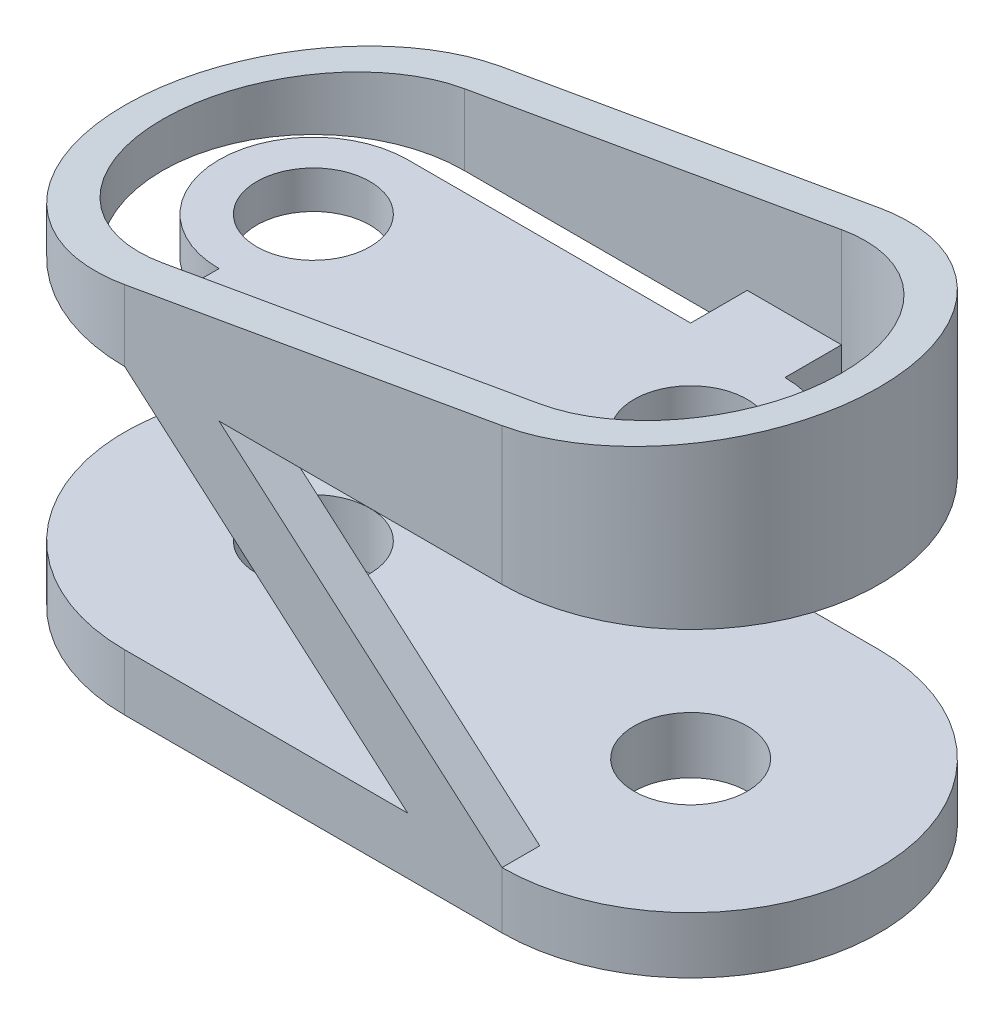
from build123d import *

# Parameters (mm, degrees)
BOSS_EXTRUDE1_START     = 80
SKETCH1_R               = 15
BOSS_EXTRUDE1_DEPTH     = 10
SKETCH1_3_R             = 15
BOSS_EXTRUDE2_DEPTH     = 15
BOSS_EXTRUDE3_DEPTH     = 10
BOSS_EXTRUDE4_DEPTH     = 10
BOSS_EXTRUDE6_DEPTH     = 60
CUT_EXTRUDE1_DEPTH      = 188.082869339
CUT_EXTRUDE1_DEPTH_BACK = 188.082869339
BOSS_EXTRUDE7_START     = 10
BOSS_EXTRUDE7_DEPTH     = 10


with BuildPart() as part:
    # Sketch1 → Boss-Extrude1 (new body)
    with BuildSketch(Plane(origin=(0, 0, 0), x_dir=(1, 0, 0), z_dir=(0, 1, 0)).offset(BOSS_EXTRUDE1_START)):
        with BuildLine():
            Line((50, 50), (25, 50))
            Line((25, 50), (25, 25))
            Line((25, 25), (-50, 25))
            ThreePointArc((-50, 25), (-75, 0), (-50, -25))
            Line((-50, -25), (-50, -50))
            Line((-50, -50), (-25, -50))
            Line((-25, -50), (-25, -25))
            Line((-25, -25), (50, -25))
            ThreePointArc((50, -25), (75, 0), (50, 25))
            Line((50, 25), (50, 50))
        make_face()
        with Locations((-50, 0)):
            Circle(SKETCH1_R, mode=Mode.SUBTRACT)
        with Locations((50, 0)):
            Circle(SKETCH1_R, mode=Mode.SUBTRACT)
    extrude(amount=BOSS_EXTRUDE1_DEPTH)



with BuildPart() as body_2:
    # Sketch1<3> → Boss-Extrude2 (new body)
    with BuildSketch(Plane(origin=(0, 0, 0), x_dir=(1, 0, 0), z_dir=(0, 1, 0))):
        with BuildLine():
            ThreePointArc((-50, 50), (-100, 0), (-50, -50))
            Line((-50, -50), (50, -50))
            ThreePointArc((50, -50), (100, 0), (50, 50))
            Line((50, 50), (-50, 50))
        make_face()
        with Locations((-50, 0)):
            Circle(SKETCH1_3_R, mode=Mode.SUBTRACT)
        with Locations((50, 0)):
            Circle(SKETCH1_3_R, mode=Mode.SUBTRACT)
    extrude(amount=BOSS_EXTRUDE2_DEPTH)


with BuildPart() as part_1:
    add(part.part)

    add(body_2.part)  # Boss-Extrude3 merges body 2
    # Sketch2 → Boss-Extrude3 (add)
    with BuildSketch(Plane.XY.offset(50)):
        Polygon((50, 15), (-25, 80), (-50, 80), (25, 15), align=None)
    extrude(amount=-BOSS_EXTRUDE3_DEPTH)

    # Sketch3 → Boss-Extrude4 (add)
    with BuildSketch(Plane(origin=(0, 0, -50), x_dir=(-1, 0, 0), z_dir=(0, 0, -1))):
        Polygon((-25, 80), (50, 15), (25, 15), (-50, 80), align=None)
    extrude(amount=-BOSS_EXTRUDE4_DEPTH)

    # Sketch4 → Boss-Extrude6 (add)
    with BuildSketch(Plane(origin=(0, 90, 0), x_dir=(1, 0, 0), z_dir=(0, 1, 0))):
        with BuildLine():
            ThreePointArc((50, -50), (100, 0), (50, 50))
            Line((50, 50), (-50, 50))
            ThreePointArc((-50, 50), (-100, 0), (-50, -50))
            Line((-50, -50), (50, -50))
        make_face()
        with BuildLine():
            Line((50, -40), (-50, -40))
            ThreePointArc((-50, -40), (-90, 0), (-50, 40))
            Line((-50, 40), (50, 40))
            ThreePointArc((50, 40), (90, 0), (50, -40))
        make_face(mode=Mode.SUBTRACT)
    extrude(amount=BOSS_EXTRUDE6_DEPTH)

    # Sketch6 → Cut-Extrude1 (cut, two sides: drawn at the far end of the back side and taken through both)
    with BuildSketch(Plane.XY.offset(-CUT_EXTRUDE1_DEPTH_BACK)):
        Polygon((-639.560936873, -5.139150907), (-100, 90), (134.669192778, 131.378510228), (674.230129651, 226.517661135), (483.951827837, 1305.639534881), (-829.839238687, 1073.982722839), align=None)
    extrude(amount=CUT_EXTRUDE1_DEPTH + CUT_EXTRUDE1_DEPTH_BACK, mode=Mode.SUBTRACT)

    # Sketch7 → Boss-Extrude7 (add)
    with BuildSketch(Plane.XZ.offset(-90).offset(BOSS_EXTRUDE7_START)):
        with BuildLine():
            Line((50, -50), (-50, -50))
            ThreePointArc((-50, -50), (-85.355339059, -35.355339059), (-100, 0))
            ThreePointArc((-100, 0), (-85.355339059, 35.355339059), (-50, 50))
            Line((-50, 50), (-27.684093833, 50))
            Line((-27.684093833, 50), (50, 50))
            ThreePointArc((50, 50), (100, 0), (50, -50))
        make_face()
        with BuildLine():
            Line((-50, -40), (50, -40))
            ThreePointArc((50, -40), (90, 0), (50, 40))
            Line((50, 40), (-50, 40))
            ThreePointArc((-50, 40), (-90, 0), (-50, -40))
        make_face(mode=Mode.SUBTRACT)
    extrude(amount=-BOSS_EXTRUDE7_DEPTH)


solid = part_1.part
